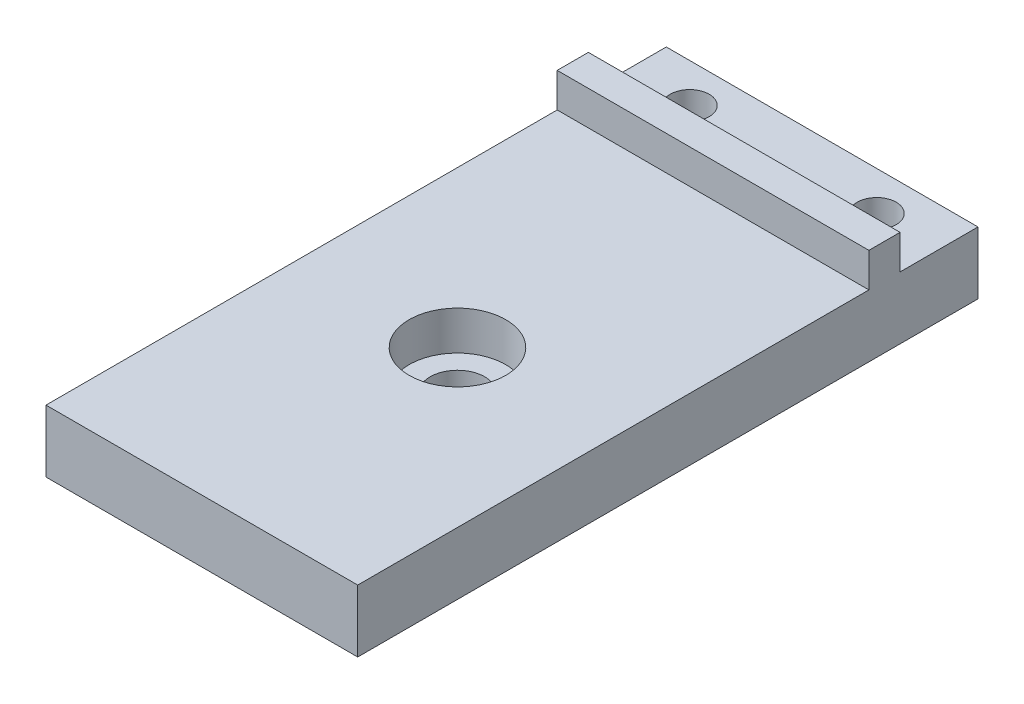
from build123d import *

# Parameters (mm, degrees)
SKETCH_1_W          = 20
SKETCH_1_H          = 32.8
EXTRUDE_1_DEPTH     = 4
CUT_EXTRUDE_1_DEPTH = 1.6
SKETCH_4_R          = 2
CUT_EXTRUDE_2_DEPTH = 1.5
SKETCH_4_3_R        = 1.25
CUT_EXTRUDE_3_DEPTH = 39.624344655
SKETCH_5_W          = 20
SKETCH_5_H          = 6.2
EXTRUDE_4_DEPTH     = 2
EXTRUDE_START       = 2
SKETCH_5_6_W        = 20
SKETCH_5_6_H        = 4
EXTRUDE_5_DEPTH     = 5
SKETCH_6_R          = 1.25
CUT_EXTRUDE_4_DEPTH = 39.913750783
SKETCH_6_3_R        = 2
CUT_EXTRUDE_5_DEPTH = 1.5
SKETCH_1_3_W        = 20
SKETCH_1_3_H        = 32.8
EXTRUDE_6_DEPTH     = 4
SKETCH_7_R          = 3.1
CUT_EXTRUDE_7_DEPTH = 2.5
SKETCH_7_4_R        = 1.75
CUT_EXTRUDE_8_DEPTH = 39.624344655


with BuildPart() as part:
    # 草图1 → 凸台-拉伸1 (new body)
    with BuildSketch(Plane(origin=(0, 0, 0), x_dir=(1, 0, 0), z_dir=(0, 1, 0))):
        with Locations((10, -16.4)):
            Rectangle(SKETCH_1_W, SKETCH_1_H)
    extrude(amount=EXTRUDE_1_DEPTH)

    # 草图3 → 切除-拉伸1 (cut)
    with BuildSketch(Plane(origin=(0, 4, 0), x_dir=(-1, 0, 0), z_dir=(0, 1, 0))):
        with BuildLine():
            Line((-12.8, 13.543428629), (-12.095952788, 2.219685343))
            ThreePointArc((-12.095952788, 2.219685343), (-10, 0.25), (-7.904047212, 2.219685343))
            Line((-7.904047212, 2.219685343), (-7.2, 13.543428629))
            ThreePointArc((-7.2, 13.543428629), (-6, 16.4), (-7.2, 19.256571371))
            Line((-7.2, 19.256571371), (-7.904047212, 30.580314657))
            ThreePointArc((-7.904047212, 30.580314657), (-10, 32.55), (-12.095952788, 30.580314657))
            Line((-12.095952788, 30.580314657), (-12.8, 19.256571371))
            ThreePointArc((-12.8, 19.256571371), (-14, 16.4), (-12.8, 13.543428629))
        make_face()
    extrude(amount=-CUT_EXTRUDE_1_DEPTH, mode=Mode.SUBTRACT)

    # 草图4 → 切除-拉伸2 (cut)
    with BuildSketch(Plane.XZ):
        with Locations(Location((4, 4, 0), (0, 0, 270))):
            Circle(SKETCH_4_R)
        with Locations(Location((4, 28.8, 0), (0, 0, 270))):
            Circle(SKETCH_4_R)
        with Locations(Location((16, 28.8, 0), (0, 0, 270))):
            Circle(SKETCH_4_R)
        with Locations(Location((16, 4, 0), (0, 0, 270))):
            Circle(SKETCH_4_R)
    extrude(amount=-CUT_EXTRUDE_2_DEPTH, mode=Mode.SUBTRACT)

    # 草图4<3> → 切除-拉伸3 (cut, through all)
    with BuildSketch(Plane.XZ):
        with Locations(Location((4, 4, 0), (0, 0, 270))):
            Circle(SKETCH_4_3_R)
        with Locations(Location((4, 28.8, 0), (0, 0, 270))):
            Circle(SKETCH_4_3_R)
        with Locations(Location((16, 4, 0), (0, 0, 270))):
            Circle(SKETCH_4_3_R)
        with Locations(Location((16, 28.8, 0), (0, 0, 270))):
            Circle(SKETCH_4_3_R)
    extrude(amount=-CUT_EXTRUDE_3_DEPTH, mode=Mode.SUBTRACT)

    # 草图5 → 凸台-拉伸4 (add)
    with BuildSketch(Plane(origin=(0, 0, 0), x_dir=(-1, 0, 0), z_dir=(0, 0, -1))):
        with Locations((-10, 3.1)):
            Rectangle(SKETCH_5_W, SKETCH_5_H)
    extrude(amount=EXTRUDE_4_DEPTH)

    # 草图5<6> → 凸台-拉伸5 (add)
    with BuildSketch(Plane(origin=(0, 0, 0), x_dir=(-1, 0, 0), z_dir=(0, 0, -1)).offset(EXTRUDE_START)):
        with Locations((-10, 2)):
            Rectangle(SKETCH_5_6_W, SKETCH_5_6_H)
    extrude(amount=EXTRUDE_5_DEPTH)

    # 草图6 → 切除-拉伸4 (cut, through all)
    with BuildSketch(Plane.XZ):
        with Locations(Location((4, -4.5, 0), (0, 0, 270))):
            Circle(SKETCH_6_R)
        with Locations(Location((16, -4.5, 0), (0, 0, 270))):
            Circle(SKETCH_6_R)
    extrude(amount=-CUT_EXTRUDE_4_DEPTH, mode=Mode.SUBTRACT)

    # 草图6<3> → 切除-拉伸5 (cut)
    with BuildSketch(Plane.XZ):
        with Locations(Location((4, -4.5, 0), (0, 0, 270))):
            Circle(SKETCH_6_3_R)
        with Locations(Location((16, -4.5, 0), (0, 0, 270))):
            Circle(SKETCH_6_3_R)
    extrude(amount=-CUT_EXTRUDE_5_DEPTH, mode=Mode.SUBTRACT)

    # 草图1<3> → 凸台-拉伸6 (add)
    with BuildSketch(Plane(origin=(0, 0, 0), x_dir=(1, 0, 0), z_dir=(0, 1, 0))):
        with Locations((10, -16.4)):
            Rectangle(SKETCH_1_3_W, SKETCH_1_3_H)
    extrude(amount=EXTRUDE_6_DEPTH)

    # 草图7 → 切除-拉伸7 (cut)
    with BuildSketch(Plane(origin=(0, 4, 0), x_dir=(1, 0, 0), z_dir=(0, 1, 0))):
        with Locations(Location((10, -16.4, 0), (0, 0, 270))):
            Circle(SKETCH_7_R)
    extrude(amount=-CUT_EXTRUDE_7_DEPTH, mode=Mode.SUBTRACT)

    # 草图7<4> → 切除-拉伸8 (cut, through all)
    with BuildSketch(Plane(origin=(0, 4, 0), x_dir=(1, 0, 0), z_dir=(0, 1, 0))):
        with Locations(Location((10, -16.4, 0), (0, 0, 270))):
            Circle(SKETCH_7_4_R)
    extrude(amount=-CUT_EXTRUDE_8_DEPTH, mode=Mode.SUBTRACT)


solid = part.part
